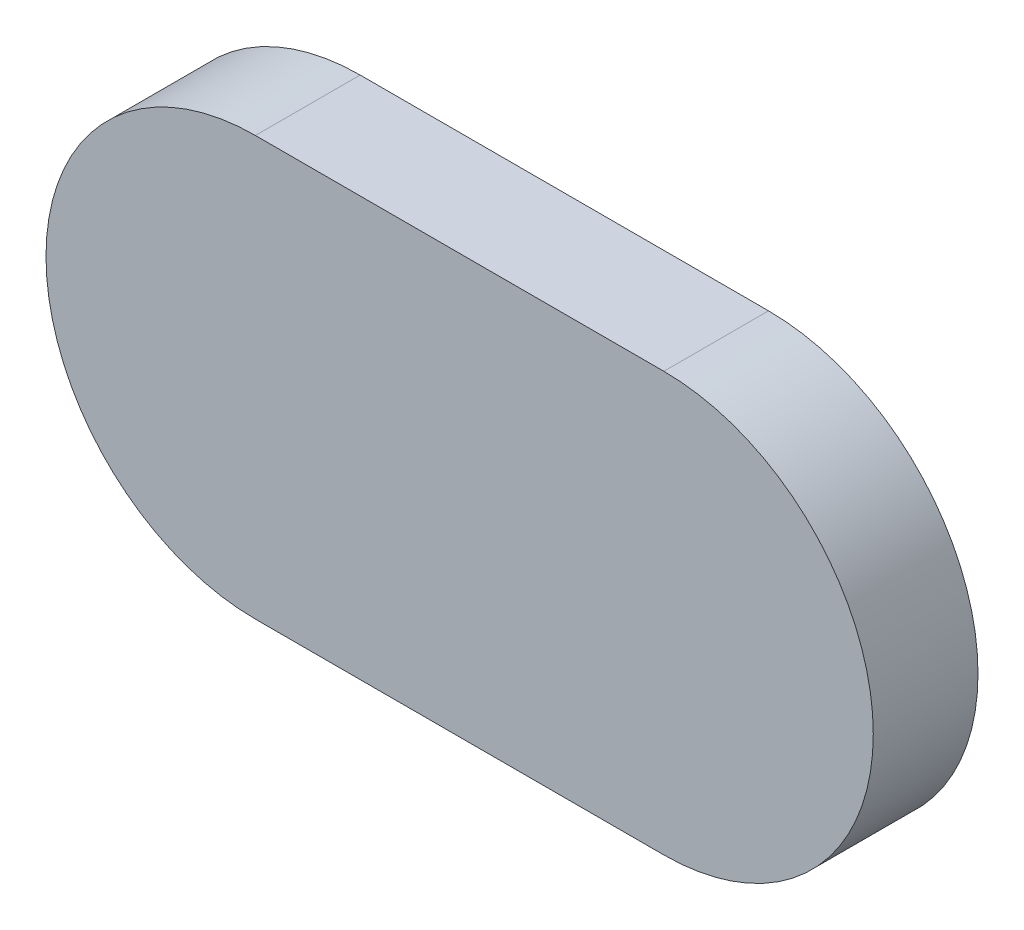
from build123d import *

# Parameters (mm, degrees)
EXTRUDE_1_DEPTH = 10


with BuildPart() as part:
    # Эскиз1 → Бобышка-Вытянуть1 (new body)
    with BuildSketch(Plane.XY):
        with BuildLine():
            Line((-19.5, 20), (19.5, 20))
            ThreePointArc((19.5, 20), (39.5, 0), (19.5, -20))
            Line((19.5, -20), (-19.5, -20))
            ThreePointArc((-19.5, -20), (-39.5, 0), (-19.5, 20))
        make_face()
    extrude(amount=EXTRUDE_1_DEPTH)


solid = part.part
